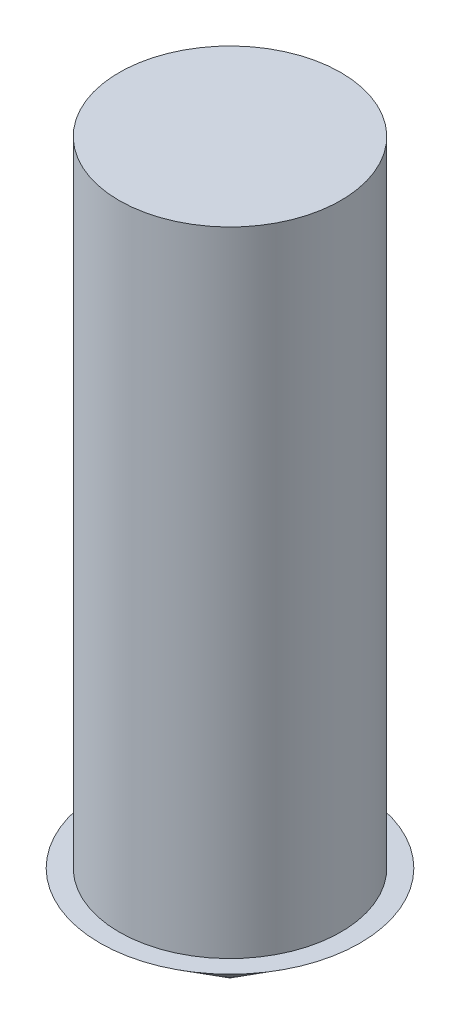
from build123d import *


with BuildPart() as part:
    # Sketch1 → Revolve1 (revolve)
    with BuildSketch(Plane.XY, mode=Mode.PRIVATE) as revolve1_sk:
        Polygon((0, 9.973625121), (0, 25), (0, 125), (17.5, 125), (17.5, 25), (20.52, 25), align=None)
    revolve(revolve1_sk.sketch.rotate(Axis((0, 25, 0), (0, 1, 0)), 90), axis=Axis((0, 25, 0), (0, 1, 0)))


solid = part.part
